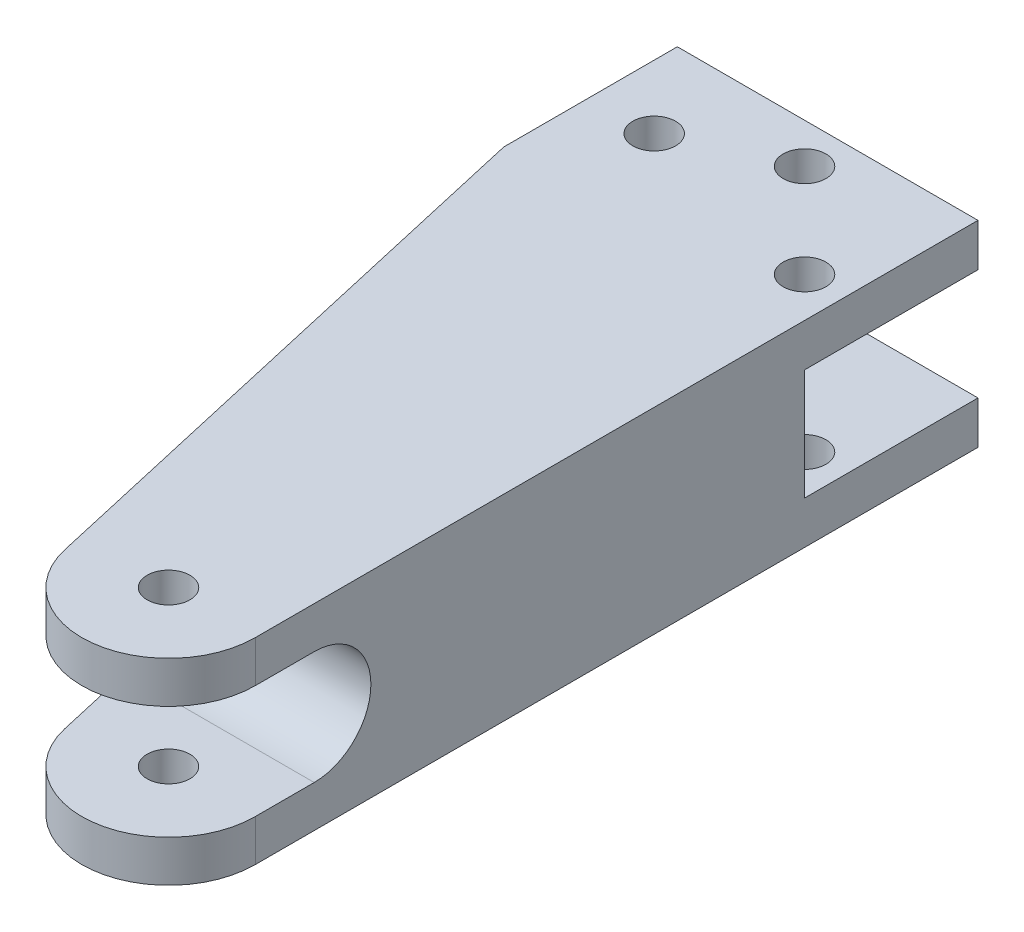
from build123d import *

# Parameters (mm, degrees)
SKETCH1_W                    = 19.05
SKETCH1_H                    = 21.59
BOSS_EXTRUDE1_DEPTH          = 88.9
CUT_EXTRUDE_THIN1_DEPTH      = 92.978604713
CUT_EXTRUDE_THIN1_DEPTH_BACK = 88.9
SKETCH4_R                    = 2.3495
CUT_EXTRUDE1_DEPTH           = 92.978604713
BOSS_EXTRUDE2_START          = -21.59
SKETCH5_R                    = 2.3495
BOSS_EXTRUDE2_DEPTH          = 21.59
SKETCH6_W                    = 38.1
SKETCH6_H                    = 12.192
CUT_EXTRUDE2_DEPTH           = 96.446647008


with BuildPart() as part:
    # Sketch1 → Boss-Extrude1 (new body)
    with BuildSketch(Plane.XY):
        Rectangle(SKETCH1_W, SKETCH1_H)
    extrude(amount=BOSS_EXTRUDE1_DEPTH)

    # Sketch3 → Cut-Extrude-Thin1 (cut, two sides: drawn at the far end of the back side and taken through both)
    with BuildSketch(Plane(origin=(0, 10.795, 0), x_dir=(1, 0, 0), z_dir=(0, 1, 0)).offset(-CUT_EXTRUDE_THIN1_DEPTH_BACK)):
        with BuildLine():
            ThreePointArc((-9.525, -79.375), (0, -88.9), (9.525, -79.375))
            Line((9.525, -79.375), (34.925, -79.375))
            ThreePointArc((34.925, -79.375), (0, -114.3), (-34.925, -79.375))
            Line((-34.925, -79.375), (-9.525, -79.375))
        make_face()
    extrude(amount=CUT_EXTRUDE_THIN1_DEPTH + CUT_EXTRUDE_THIN1_DEPTH_BACK, mode=Mode.SUBTRACT)

    # Sketch4 → Cut-Extrude1 (cut, through all)
    with BuildSketch(Plane(origin=(0, 10.795, 0), x_dir=(1, 0, 0), z_dir=(0, 1, 0))):
        with Locations(Location((0, -79.375, 0), (0, 0, 270))):
            Circle(SKETCH4_R)
        with Locations(Location((5.1435, -14.6685, 0), (0, 0, 270))):
            Circle(SKETCH4_R)
        with Locations(Location((-5.1435, -4.3815, 0), (0, 0, 270))):
            Circle(SKETCH4_R)
    extrude(amount=-CUT_EXTRUDE1_DEPTH, mode=Mode.SUBTRACT)

    # Sketch5 → Boss-Extrude2 (add)
    with BuildSketch(Plane(origin=(0, 10.795, 0), x_dir=(1, 0, 0), z_dir=(0, 1, 0)).offset(BOSS_EXTRUDE2_START)):
        with BuildLine():
            Line((-9.525, -79.375), (-9.525, 0))
            Line((-9.525, 0), (-23.495, 0))
            Line((-23.495, 0), (-23.495, -19.05))
            Line((-23.495, -19.05), (-9.287597736, -81.488327539))
            ThreePointArc((-9.287597736, -81.488327539), (-9.465463365, -80.438310059), (-9.525, -79.375))
        make_face()
        with Locations(Location((-16.51, -9.525, 0), (0, 0, 270))):
            Circle(SKETCH5_R, mode=Mode.SUBTRACT)
    extrude(amount=BOSS_EXTRUDE2_DEPTH)

    # Sketch6 → Cut-Extrude2 (cut, through all)
    with BuildSketch(Plane(origin=(9.525, 0, 0), x_dir=(0, 0, -1), z_dir=(1, 0, 0))):
        Rectangle(SKETCH6_W, SKETCH6_H)
        with BuildLine():
            Line((-92.075, -6.223), (-72.898, -6.223))
            ThreePointArc((-72.898, -6.223), (-66.675, 0), (-72.898, 6.223))
            Line((-72.898, 6.223), (-92.075, 6.223))
            Line((-92.075, 6.223), (-92.075, -6.223))
        make_face()
    extrude(amount=-CUT_EXTRUDE2_DEPTH, mode=Mode.SUBTRACT)


solid = part.part
